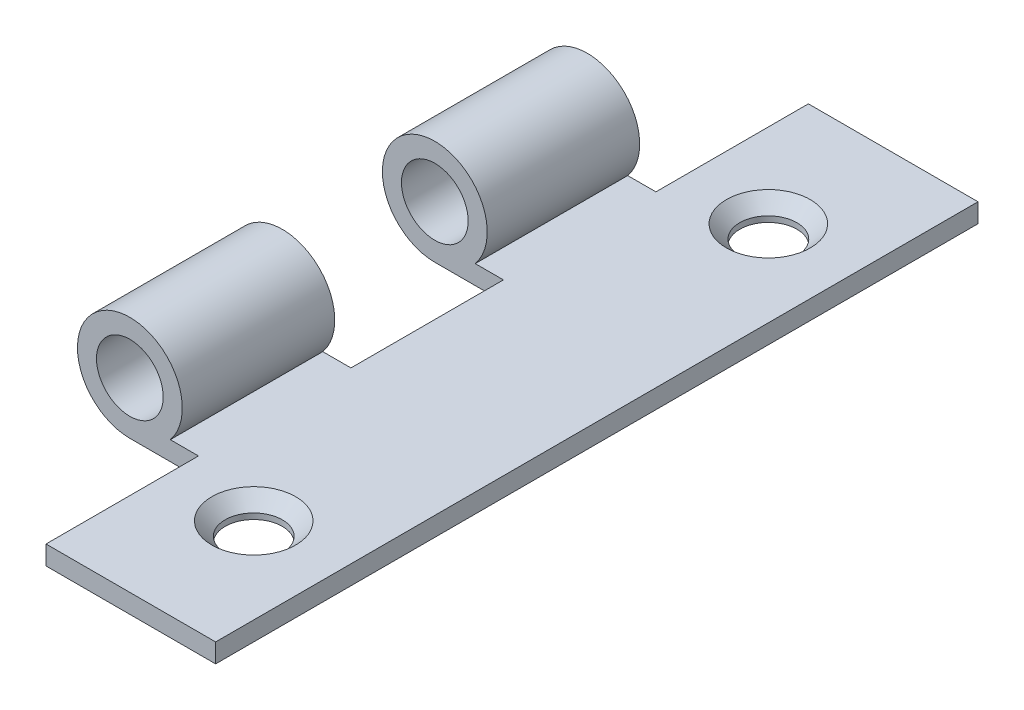
from build123d import *

# Parameters (mm, degrees)
ESQUISSE1_R                  = 1.75
BOSS_EXTRU_1_DEPTH           = 40
ENL_V_MAT_EXTRU_3_DEPTH      = 20
ENL_V_MAT_EXTRU_3_DEPTH_BACK = 20
ESQUISSE2_W                  = 17.8
ESQUISSE2_H                  = 8
D_GAGEMENT_M31_D             = 3
D_GAGEMENT_M31_DEPTH         = 10
D_GAGEMENT_M31_CSINK_D       = 4.4
D_GAGEMENT_M31_CSINK_ANGLE   = 90
D_GAGEMENT_M31_TIP           = 0.901290929


with BuildPart() as part:
    # Esquisse1 → Boss.-Extru.1 (new body)
    with BuildSketch(Plane.XY):
        with BuildLine():
            Line((12.5, -1.75), (2.121320344, -1.75))
            ThreePointArc((2.121320344, -1.75), (-1.17260394, 2.487468593), (0, -2.75))
            Line((0, -2.75), (12.5, -2.75))
            Line((12.5, -2.75), (12.5, -1.75))
        make_face()
        Circle(ESQUISSE1_R, mode=Mode.SUBTRACT)
    extrude(amount=BOSS_EXTRU_1_DEPTH)

    # Esquisse2 → Enlèv. mat.-Extru.3 (cut, two sides: drawn at the far end of the back side and taken through both)
    with BuildSketch(Plane(origin=(0, -1.75, 0), x_dir=(1, 0, 0), z_dir=(0, 1, 0)).offset(-ENL_V_MAT_EXTRU_3_DEPTH_BACK)):
        with Locations((-5.3, -20)):
            Rectangle(ESQUISSE2_W, ESQUISSE2_H)
        with Locations((-5.3, -36)):
            Rectangle(ESQUISSE2_W, ESQUISSE2_H)
        with Locations((-5.3, -4)):
            Rectangle(ESQUISSE2_W, ESQUISSE2_H)
    extrude(amount=ENL_V_MAT_EXTRU_3_DEPTH + ENL_V_MAT_EXTRU_3_DEPTH_BACK, mode=Mode.SUBTRACT)

    # Dégagement M31
    with Locations(Plane(origin=(0, -1.75, 0), x_dir=(1, 0, 0), z_dir=(0, 1, 0))):
        with Locations((8, -33.5), (8, -6.5)):
            CounterSinkHole(D_GAGEMENT_M31_D / 2, D_GAGEMENT_M31_CSINK_D / 2, depth=D_GAGEMENT_M31_DEPTH, counter_sink_angle=D_GAGEMENT_M31_CSINK_ANGLE)
            with Locations((0, 0, -(D_GAGEMENT_M31_DEPTH + D_GAGEMENT_M31_TIP / 2))):  # 118° drill point
                Cone(0, D_GAGEMENT_M31_D / 2, D_GAGEMENT_M31_TIP, mode=Mode.SUBTRACT)


solid = part.part
